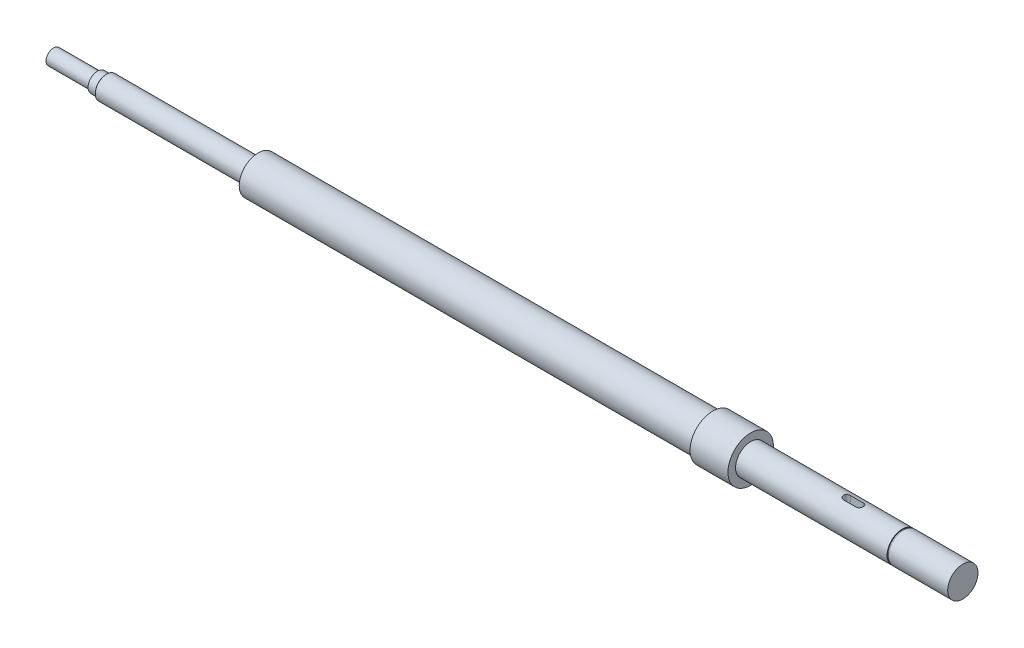
from build123d import *

# Parameters (mm, degrees)
SKETCH1_R           = 500
BOSS_EXTRUDE1_DEPTH = 600
SKETCH2_OUTSIDE_W   = 1309.246
SKETCH2_OUTSIDE_H   = 1309.246
SKETCH2_OUTSIDE_R   = 5
CUT_EXTRUDE1_DEPTH  = 29
SKETCH3_OUTSIDE_W   = 1309.246
SKETCH3_OUTSIDE_H   = 1309.246
SKETCH3_OUTSIDE_R   = 6.25
CUT_EXTRUDE2_DEPTH  = 5
SKETCH4_OUTSIDE_W   = 1309.246
SKETCH4_OUTSIDE_H   = 1309.246
SKETCH4_OUTSIDE_R   = 5.75
CUT_EXTRUDE3_DEPTH  = 1
SKETCH5_OUTSIDE_W   = 1309.246
SKETCH5_OUTSIDE_H   = 1309.246
SKETCH5_OUTSIDE_R   = 7.5
CUT_EXTRUDE4_DEPTH  = 100
SKETCH6_OUTSIDE_W   = 1309.246
SKETCH6_OUTSIDE_H   = 1309.246
SKETCH6_OUTSIDE_R   = 12.5
CUT_EXTRUDE5_DEPTH  = 300
SKETCH7_OUTSIDE_W   = 1309.246
SKETCH7_OUTSIDE_H   = 1309.246
SKETCH7_OUTSIDE_R   = 15
CUT_EXTRUDE6_DEPTH  = 25
SKETCH8_OUTSIDE_W   = 1309.246
SKETCH8_OUTSIDE_H   = 1309.246
SKETCH8_OUTSIDE_R   = 10
CUT_EXTRUDE7_DEPTH  = 100
SKETCH9_OUTSIDE_W   = 1309.246
SKETCH9_OUTSIDE_H   = 1309.246
SKETCH9_OUTSIDE_R   = 9.5
CUT_EXTRUDE8_DEPTH  = 1
SKETCH10_OUTSIDE_W  = 1309.246
SKETCH10_OUTSIDE_H  = 1309.246
SKETCH10_OUTSIDE_R  = 10
CUT_EXTRUDE10_DEPTH = 39
CUT_EXTRUDE11_DEPTH = 25


with BuildPart() as part:
    # Sketch1 → Boss-Extrude1 (new body)
    with BuildSketch(Plane(origin=(0, 0, 0), x_dir=(0, 0, -1), z_dir=(1, 0, 0))):
        Circle(SKETCH1_R)
    extrude(amount=BOSS_EXTRUDE1_DEPTH)

    # Sketch2 outside → Cut-Extrude1 (cut)
    with BuildSketch(Plane.ZY):
        Rectangle(SKETCH2_OUTSIDE_W, SKETCH2_OUTSIDE_H)
        Circle(SKETCH2_OUTSIDE_R, mode=Mode.SUBTRACT)
    extrude(amount=-CUT_EXTRUDE1_DEPTH, mode=Mode.SUBTRACT)

    # Sketch3 outside → Cut-Extrude2 (cut)
    with BuildSketch(Plane.ZY.offset(-29)):
        Rectangle(SKETCH3_OUTSIDE_W, SKETCH3_OUTSIDE_H)
        Circle(SKETCH3_OUTSIDE_R, mode=Mode.SUBTRACT)
    extrude(amount=-CUT_EXTRUDE2_DEPTH, mode=Mode.SUBTRACT)

    # Sketch4 outside → Cut-Extrude3 (cut)
    with BuildSketch(Plane.ZY.offset(-34)):
        Rectangle(SKETCH4_OUTSIDE_W, SKETCH4_OUTSIDE_H)
        Circle(SKETCH4_OUTSIDE_R, mode=Mode.SUBTRACT)
    extrude(amount=-CUT_EXTRUDE3_DEPTH, mode=Mode.SUBTRACT)

    # Sketch5 outside → Cut-Extrude4 (cut)
    with BuildSketch(Plane.ZY.offset(-35)):
        Rectangle(SKETCH5_OUTSIDE_W, SKETCH5_OUTSIDE_H)
        Circle(SKETCH5_OUTSIDE_R, mode=Mode.SUBTRACT)
    extrude(amount=-CUT_EXTRUDE4_DEPTH, mode=Mode.SUBTRACT)

    # Sketch6 outside → Cut-Extrude5 (cut)
    with BuildSketch(Plane.ZY.offset(-135)):
        Rectangle(SKETCH6_OUTSIDE_W, SKETCH6_OUTSIDE_H)
        Circle(SKETCH6_OUTSIDE_R, mode=Mode.SUBTRACT)
    extrude(amount=-CUT_EXTRUDE5_DEPTH, mode=Mode.SUBTRACT)

    # Sketch7 outside → Cut-Extrude6 (cut)
    with BuildSketch(Plane.ZY.offset(-435)):
        Rectangle(SKETCH7_OUTSIDE_W, SKETCH7_OUTSIDE_H)
        Circle(SKETCH7_OUTSIDE_R, mode=Mode.SUBTRACT)
    extrude(amount=-CUT_EXTRUDE6_DEPTH, mode=Mode.SUBTRACT)

    # Sketch8 outside → Cut-Extrude7 (cut)
    with BuildSketch(Plane.ZY.offset(-460)):
        Rectangle(SKETCH8_OUTSIDE_W, SKETCH8_OUTSIDE_H)
        Circle(SKETCH8_OUTSIDE_R, mode=Mode.SUBTRACT)
    extrude(amount=-CUT_EXTRUDE7_DEPTH, mode=Mode.SUBTRACT)

    # Sketch9 outside → Cut-Extrude8 (cut)
    with BuildSketch(Plane.ZY.offset(-560)):
        Rectangle(SKETCH9_OUTSIDE_W, SKETCH9_OUTSIDE_H)
        Circle(SKETCH9_OUTSIDE_R, mode=Mode.SUBTRACT)
    extrude(amount=-CUT_EXTRUDE8_DEPTH, mode=Mode.SUBTRACT)

    # Sketch10 outside → Cut-Extrude10 (cut)
    with BuildSketch(Plane.ZY.offset(-561)):
        Rectangle(SKETCH10_OUTSIDE_W, SKETCH10_OUTSIDE_H)
        Circle(SKETCH10_OUTSIDE_R, mode=Mode.SUBTRACT)
    extrude(amount=-CUT_EXTRUDE10_DEPTH, mode=Mode.SUBTRACT)

    # Sketch14<3> → Cut-Extrude11 (cut)
    with BuildSketch(Plane(origin=(0, 30, 0), x_dir=(1, 0, 0), z_dir=(0, 1, 0))):
        with BuildLine():
            Line((18.890286749, 1.405946281), (24.942306626, 1.405946281))
            ThreePointArc((24.942306626, 1.405946281), (26.348252906, 0), (24.942306626, -1.405946281))
            Line((24.942306626, -1.405946281), (18.890286749, -1.405946281))
            ThreePointArc((18.890286749, -1.405946281), (17.484340469, 0), (18.890286749, 1.405946281))
        make_face()
        with BuildLine():
            Line((523.62027087, 2.365533558), (532.010381059, 2.365533558))
            ThreePointArc((532.010381059, 2.365533558), (534.375914617, 0), (532.010381059, -2.365533558))
            Line((532.010381059, -2.365533558), (523.62027087, -2.365533558))
            ThreePointArc((523.62027087, -2.365533558), (521.254737312, 0), (523.62027087, 2.365533558))
        make_face()
    extrude(amount=-CUT_EXTRUDE11_DEPTH, mode=Mode.SUBTRACT)


solid = part.part
